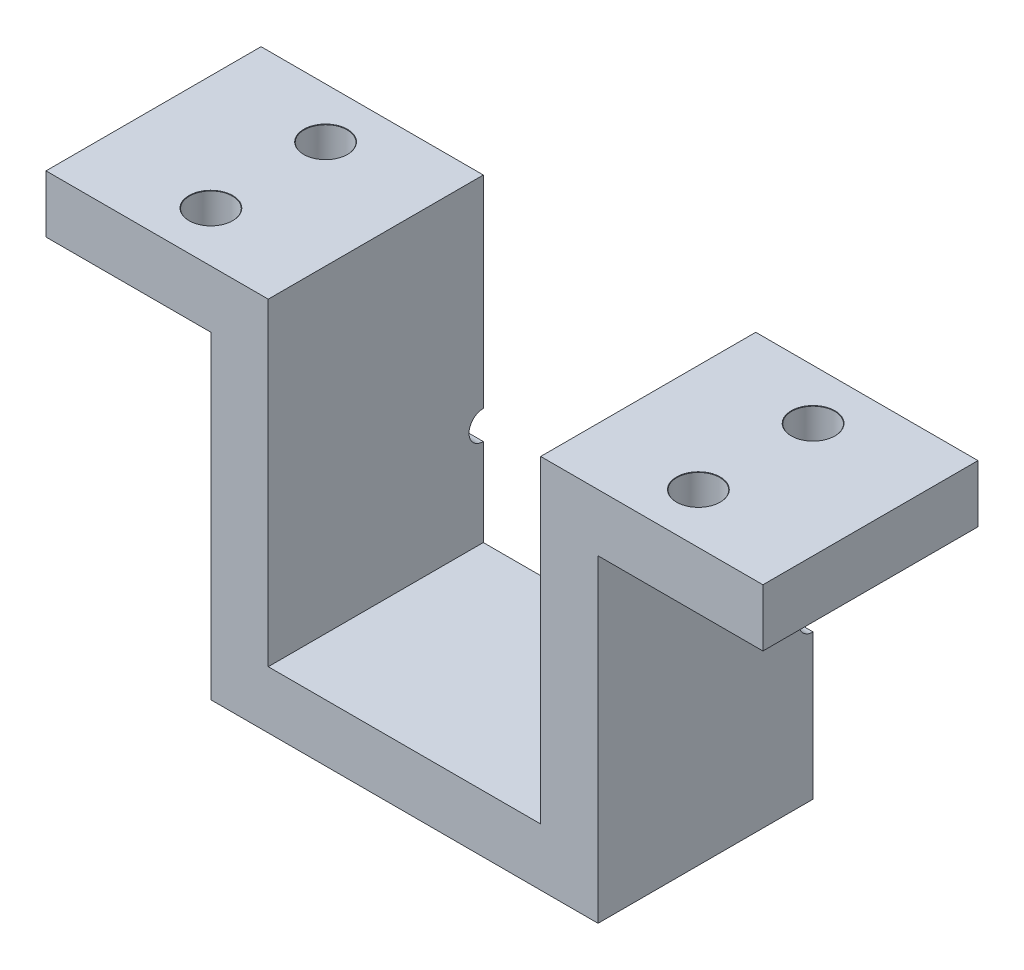
from build123d import *

# Parameters (mm, degrees)
SKETCH_2_W            = 27
SKETCH_2_H            = 15
EXTRUDE_1_DEPTH       = 22.2
SHELL_2_T             = -4
SKETCH_3_R            = 1
CUT_EXTRUDE_1_DEPTH   = 32.2
SKETCH_4_W            = 50
SKETCH_4_H            = 15
EXTRUDE_2_DEPTH       = 4
SKETCH_5_W            = 19
SKETCH_5_H            = 15
CUT_EXTRUDE_2_DEPTH   = 8
F_3_0MM_1_D           = 3
F_3_0MM_1_CSINK_D     = 3.05
F_3_0MM_1_CSINK_ANGLE = 90


with BuildPart() as part:
    # 草图2 → 凸台-拉伸1 (new body)
    with BuildSketch(Plane(origin=(0, 0, 0), x_dir=(1, 0, 0), z_dir=(0, 1, 0))):
        with Locations((13.5, 7.5)):
            Rectangle(SKETCH_2_W, SKETCH_2_H)
    extrude(amount=EXTRUDE_1_DEPTH)

    # 抽壳2
    shell_2_openings = [part.faces().sort_by_distance(p)[0] for p in [
        (13.5, 11.1, -15),
        (13.5, 22.2, -7.5),
        (13.5, 11.1, 0),
    ]]
    offset(amount=SHELL_2_T, openings=shell_2_openings, kind=Kind.INTERSECTION)

    # 草图3 → 切除-拉伸1 (cut)
    with BuildSketch(Plane.ZY):
        with Locations((-15, 11.1)):
            Circle(SKETCH_3_R)
    extrude(amount=-CUT_EXTRUDE_1_DEPTH, mode=Mode.SUBTRACT)

    # 草图4 → 凸台-拉伸2 (add)
    with BuildSketch(Plane(origin=(0, 22.2, 0), x_dir=(1, 0, 0), z_dir=(0, 1, 0))):
        with Locations((13.5, 7.5)):
            Rectangle(SKETCH_4_W, SKETCH_4_H)
    extrude(amount=EXTRUDE_2_DEPTH)

    # 草图5 → 切除-拉伸2 (cut)
    with BuildSketch(Plane.XZ.offset(-22.2)):
        with Locations((13.5, -7.5)):
            Rectangle(SKETCH_5_W, SKETCH_5_H)
    extrude(amount=-CUT_EXTRUDE_2_DEPTH, mode=Mode.SUBTRACT)

    # Ø3.0mm 暗销孔1 (through all)
    with Locations(Plane(origin=(0, 26.2, 0), x_dir=(1, 0, 0), z_dir=(0, 1, 0))):
        with Locations((-3.5, 11.5), (-3.5, 3.5), (30.5, 11.5), (30.5, 3.5)):
            CounterSinkHole(F_3_0MM_1_D / 2, F_3_0MM_1_CSINK_D / 2, counter_sink_angle=F_3_0MM_1_CSINK_ANGLE)


solid = part.part
